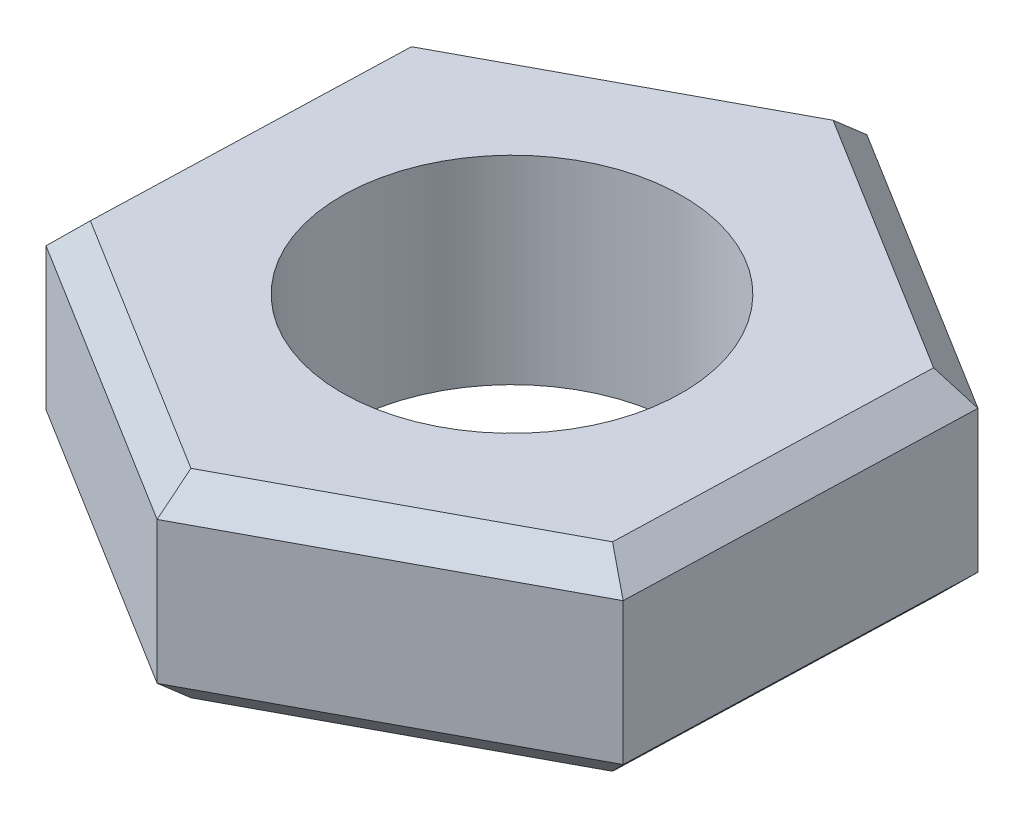
from build123d import *

# Parameters (mm, degrees)
SKETCH_1_R      = 6
EXTRUDE_1_DEPTH = 7
CHAMFER_1_SIZE  = 1


with BuildPart() as part:
    # 草图1 → 拉伸1 (new body)
    with BuildSketch(Plane(origin=(0, 0, 0), x_dir=(1, 0, 0), z_dir=(0, 1, 0))):
        Polygon((10.304006871, -6.389635546), (10.685590139, 5.728713938), (0.381583268, 12.118349484), (-10.304006871, 6.389635546), (-10.685590139, -5.728713938), (-0.381583268, -12.118349484), align=None)
        with Locations(Location((0, 0, 0), (0, 0, 270))):
            Circle(SKETCH_1_R, mode=Mode.SUBTRACT)
    extrude(amount=EXTRUDE_1_DEPTH)

    # 倒角1
    chamfer_1_edges = [part.edges().sort_by_distance(p)[0] for p in [
        (5.533586703, 7, -8.923531711),
        (-4.961211801, 7, -9.253992515),
        (-10.494798505, 7, -0.330460804),
        (-5.533586703, 7, 8.923531711),
        (4.961211801, 7, 9.253992515),
        (-5.533586703, 0, 8.923531711),
        (-10.494798505, 0, -0.330460804),
        (-4.961211801, 0, -9.253992515),
        (10.494798505, 7, 0.330460804),
        (5.533586703, 0, -8.923531711),
        (10.494798505, 0, 0.330460804),
        (4.961211801, 0, 9.253992515),
    ]]
    chamfer(chamfer_1_edges, length=CHAMFER_1_SIZE)


solid = part.part
